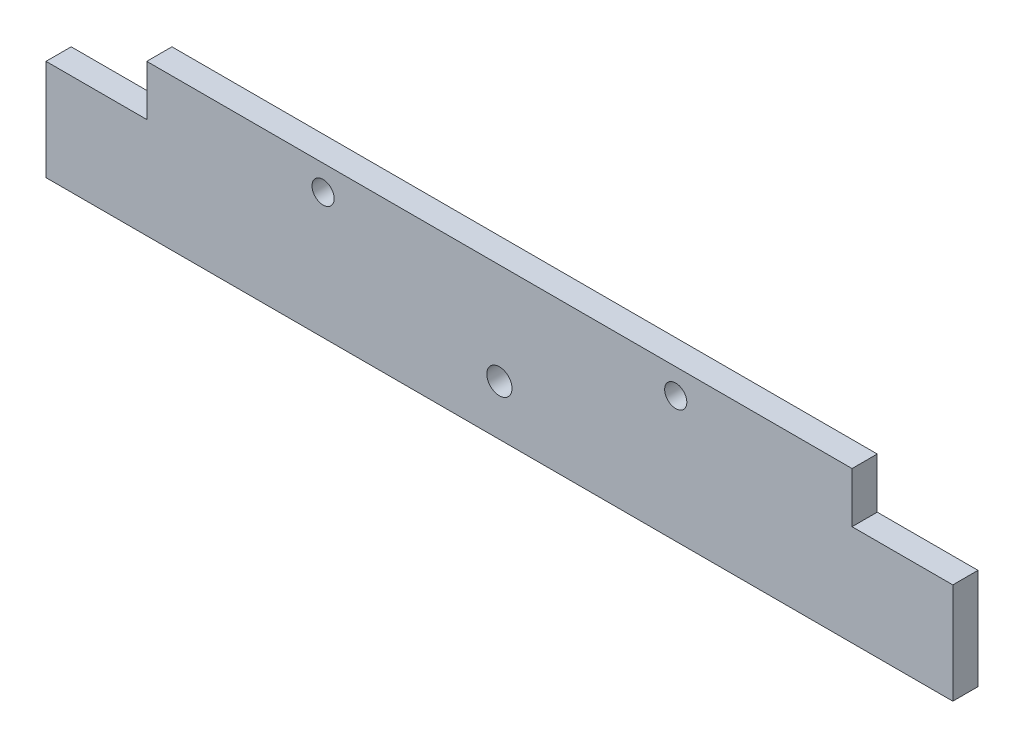
from build123d import *

# Parameters (mm, degrees)
DODANIE_WYCI_GNI_CIE1_DEPTH = 5
SZKIC2_R                    = 2.2
WYTNIJ_WYCI_GNI_CIE1_DEPTH  = 10
SZKIC6_R                    = 2.5
WYTNIJ_WYCI_GNI_CIE3_DEPTH  = 163.864974749


with BuildPart() as part:
    # Szkic1 → Dodanie-wyciągnięcie1 (new body)
    with BuildSketch(Plane.XY):
        Polygon((0, -10), (-20, -10), (-20, -30), (160, -30), (160, -10), (140, -10), (140, 0), (0, 0), align=None)
    extrude(amount=DODANIE_WYCI_GNI_CIE1_DEPTH)

    # Szkic2 → Wytnij-wyciągnięcie1 (cut)
    with BuildSketch(Plane.XY.offset(5)):
        with Locations((35, -5)):
            Circle(SZKIC2_R)
        with Locations((105, -5)):
            Circle(SZKIC2_R)
    extrude(amount=-WYTNIJ_WYCI_GNI_CIE1_DEPTH, mode=Mode.SUBTRACT)

    # Szkic6 → Wytnij-wyciągnięcie3 (cut, through all)
    with BuildSketch(Plane.XY.offset(5)):
        with Locations((70, -20)):
            Circle(SZKIC6_R)
    extrude(amount=-WYTNIJ_WYCI_GNI_CIE3_DEPTH, mode=Mode.SUBTRACT)


solid = part.part
